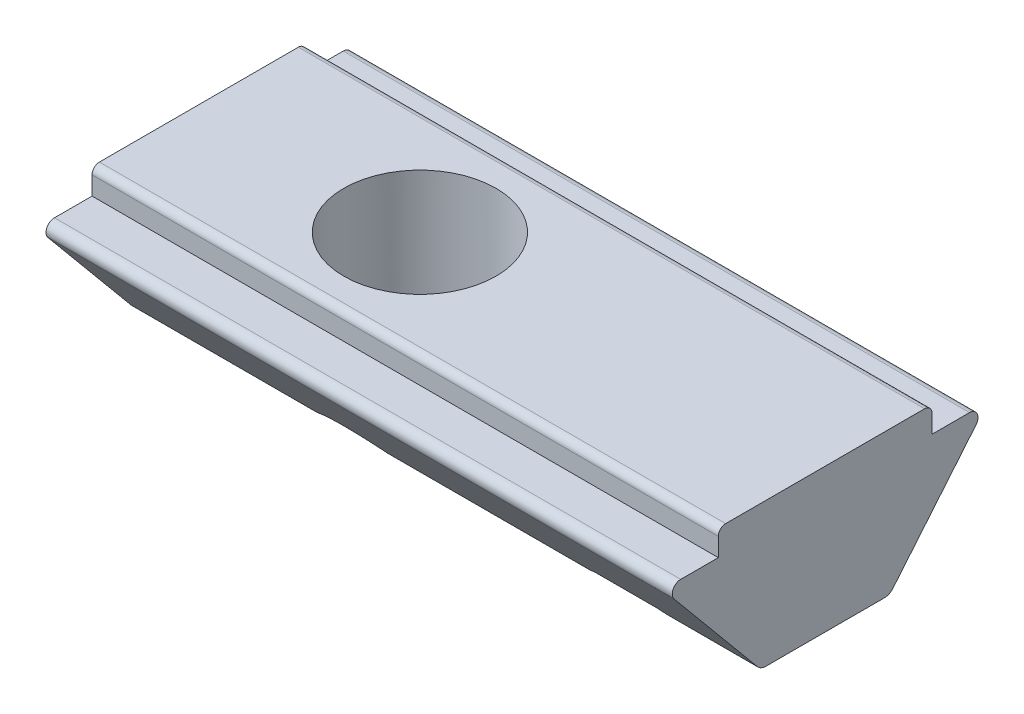
from build123d import *

# Parameters (mm, degrees)
BOSS_EXTRUDE1_DEPTH = 17
FILLET1_R           = 0.3
FILLET2_R           = 0.2
SKETCH2_W           = 2.1
SKETCH2_H           = 0.2
TAPPED_HOLE1_D      = 4.134


with BuildPart() as part:
    # Sketch1 → Boss-Extrude1 (new body)
    with BuildSketch(Plane(origin=(-6, 0, 0), x_dir=(0, 0, -1), z_dir=(1, 0, 0))):
        with BuildLine():
            Line((2.9, 0), (-2.9, 0))
            Line((-2.9, 0), (-2.9, -0.7))
            Line((-2.9, -0.7), (-3.92, -0.7))
            ThreePointArc((-3.92, -0.7), (-4.128228295, -0.832322075), (-4.096863547, -1.077034982))
            Line((-4.096863547, -1.077034982), (-1.75, -3.9))
            Line((-1.75, -3.9), (1.75, -3.9))
            Line((1.75, -3.9), (4.096863547, -1.077034982))
            ThreePointArc((4.096863547, -1.077034982), (4.128228295, -0.832322075), (3.92, -0.7))
            Line((3.92, -0.7), (2.9, -0.7))
            Line((2.9, -0.7), (2.9, 0))
        make_face()
    extrude(amount=BOSS_EXTRUDE1_DEPTH)

    # Fillet1
    fillet1_edges = [part.edges().sort_by_distance(p)[0] for p in [
        (2.5, -3.9, -1.75),
        (2.5, -3.9, 1.75),
    ]]
    fillet(fillet1_edges, radius=FILLET1_R)

    # Fillet2
    fillet2_edges = [part.edges().sort_by_distance(p)[0] for p in [
        (2.5, 0, 2.9),
        (2.5, 0, -2.9),
    ]]
    fillet(fillet2_edges, radius=FILLET2_R)

    # Sketch2 → Cut-Revolve1 (revolve, cut)
    with BuildSketch(Plane(origin=(7.5, 0, 0), x_dir=(0, 0, -1), z_dir=(1, 0, 0))):
        with Locations((1.05, -3.8)):
            Rectangle(SKETCH2_W, SKETCH2_H)
    revolve(axis=Axis((7.5, 1.665548573, 0), (0, -1, 0)), mode=Mode.SUBTRACT)

    # Sketch3 → Revolve1 (revolve)
    with BuildSketch(Plane(origin=(7.5, 0, 0), x_dir=(0, 0, -1), z_dir=(1, 0, 0)), mode=Mode.PRIVATE) as revolve1_sk:
        with BuildLine():
            Line((1.732050808, -3.7), (0, -3.7))
            Line((0, -3.7), (0, -4.7))
            ThreePointArc((0, -4.7), (1, -4.432050808), (1.732050808, -3.7))
        make_face()
    revolve(revolve1_sk.sketch.rotate(Axis((7.5, 0, 0), (0, -1, 0)), 180), axis=Axis((7.5, 0, 0), (0, -1, 0)))

    # Tapped Hole1 (through all)
    with Locations(Plane(origin=(0, 0, 0), x_dir=(1, 0, 0), z_dir=(0, 1, 0))):
        with Locations((0, 0)):
            Hole(TAPPED_HOLE1_D / 2)


solid = part.part
